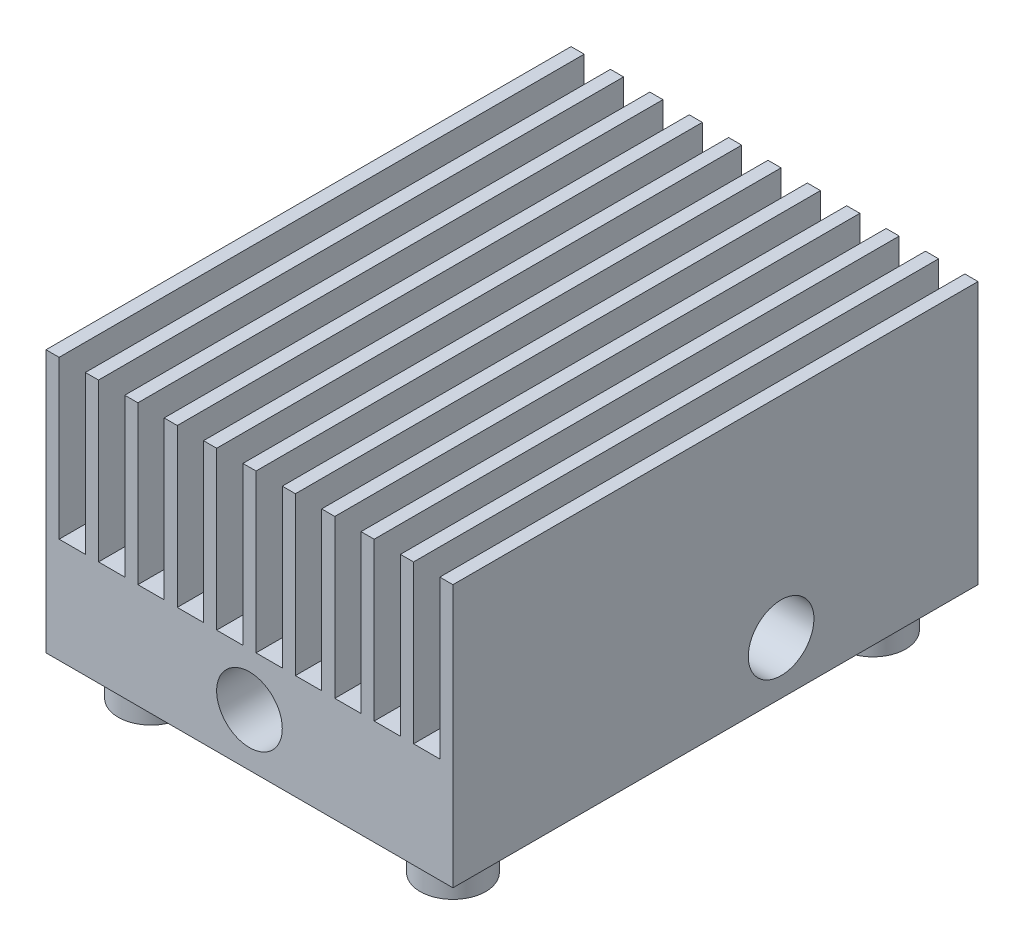
from build123d import *

# Parameters (mm, degrees)
EXTRUDE1_DEPTH       = 40
SKETCH2_R            = 2.5
EXTRUDE2_DEPTH       = 48.331279298
SKETCH3_R            = 2.5
EXTRUDE3_DEPTH       = 55.415071442
SKETCH4_R            = 2.5
SKETCH4_R_2          = 1.5
EXTRUDE4_DEPTH       = 3
LPATTERN6_COUNT      = 2
LPATTERN6_PITCH      = 23
LPATTERN6_COUNT_DIR2 = 2
LPATTERN6_PITCH_DIR2 = 32


with BuildPart() as part:
    # Sketch1 → Extrude1 (new body)
    with BuildSketch(Plane.XY):
        Polygon((-15.5, 0), (-15.5, 20), (-14.5, 20), (-14.5, 8), (-12.5, 8), (-12.5, 20), (-11.5, 20), (-11.5, 8), (-9.5, 8), (-9.5, 20), (-8.5, 20), (-8.5, 8), (-6.5, 8), (-6.5, 20), (-5.5, 20), (-5.5, 8), (-3.5, 8), (-3.5, 20), (-2.5, 20), (-2.5, 8), (-0.5, 8), (-0.5, 20), (0.5, 20), (0.5, 8), (2.5, 8), (2.5, 20), (3.5, 20), (3.5, 8), (5.5, 8), (5.5, 20), (6.5, 20), (6.5, 8), (8.5, 8), (8.5, 20), (9.5, 20), (9.5, 8), (11.5, 8), (11.5, 20), (12.5, 20), (12.5, 8), (14.5, 8), (14.5, 20), (15.5, 20), (15.5, 0), align=None)
    extrude(amount=-EXTRUDE1_DEPTH)

    # Sketch2 → Extrude2 (cut, through all)
    with BuildSketch(Plane.XY):
        with Locations((0, 4)):
            Circle(SKETCH2_R)
    extrude(amount=-EXTRUDE2_DEPTH, mode=Mode.SUBTRACT)

    # Sketch3 → Extrude3 (cut, through all)
    with BuildSketch(Plane(origin=(15.5, 0, 0), x_dir=(0, 0, -1), z_dir=(1, 0, 0))):
        with Locations(Location((25, 4, 0), (0, 0, 90))):
            Circle(SKETCH3_R)
    extrude(amount=-EXTRUDE3_DEPTH, mode=Mode.SUBTRACT)

    # Sketch4 → Extrude4 (add)
    with BuildSketch(Plane.XZ):
        with Locations((11.5, -4)):
            Circle(SKETCH4_R)
        with Locations((11.5, -4)):
            Circle(SKETCH4_R_2, mode=Mode.SUBTRACT)
    extrude4 = extrude(amount=EXTRUDE4_DEPTH)

    # LPattern6: Extrude4 2 × 2
    with Locations(*[(-i * LPATTERN6_PITCH, 0, -j * LPATTERN6_PITCH_DIR2) for i in range(LPATTERN6_COUNT) for j in range(LPATTERN6_COUNT_DIR2) if (i, j) != (0, 0)]):
        add(extrude4)


solid = part.part
